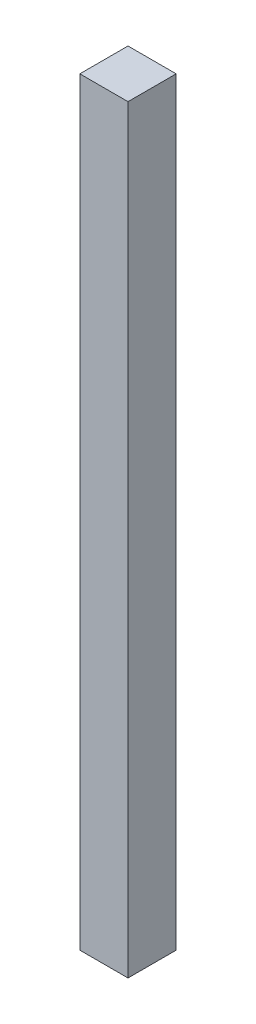
from build123d import *

# Parameters (mm, degrees)
SKETCH2_W           = 4
SKETCH2_H           = 4
BOSS_EXTRUDE1_DEPTH = 63


with BuildPart() as part:
    # Sketch2 → Boss-Extrude1 (new body)
    with BuildSketch(Plane(origin=(0, 0, 0), x_dir=(1, 0, 0), z_dir=(0, 1, 0))):
        Rectangle(SKETCH2_W, SKETCH2_H)
    extrude(amount=BOSS_EXTRUDE1_DEPTH)


solid = part.part
